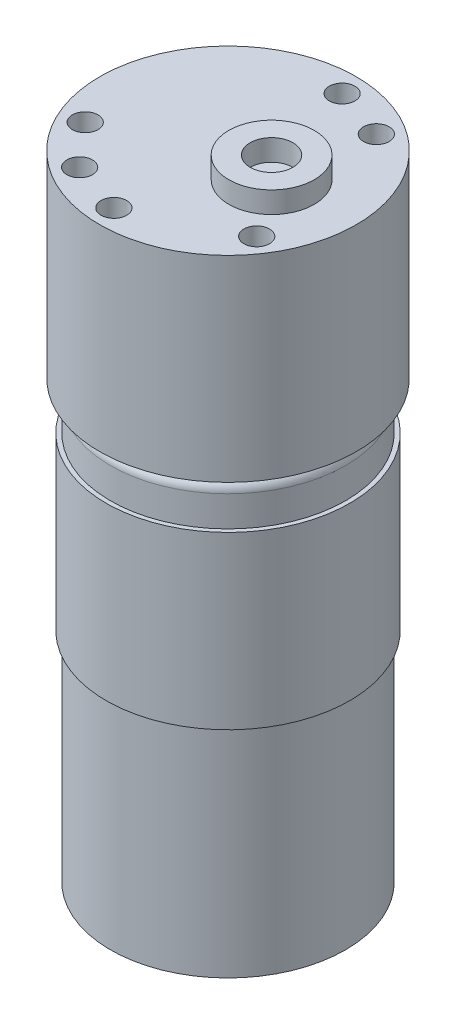
from build123d import *

# Parameters (mm, degrees)
SKETCH5_R             = 1.5
CUT_EXTRUDE1_DEPTH    = 4
SKETCH3_R             = 5
SKETCH3_R_2           = 2.5
BOSS_EXTRUDE3_DEPTH   = 2.5
BODY_MOVE_COPY1_ANGLE = 180
BODY_MOVE_COPY2_ANGLE = 180
BODY_MOVE_COPY3_ANGLE = 90


with BuildPart() as part:
    # Sketch1 → Revolve1 (revolve)
    with BuildSketch(Plane.XY, mode=Mode.PRIVATE) as revolve1_sk:
        with BuildLine():
            Line((33.701320748, 0), (33.701320748, 13.75))
            Line((33.701320748, 13.75), (21.201320748, 13.75))
            Line((21.201320748, 13.75), (8.201320748, 13.75))
            Line((8.201320748, 13.75), (8.201320748, 14.25))
            Line((8.201320748, 14.25), (-11.798679252, 14.25))
            Line((-11.798679252, 14.25), (-11.798679252, 13.75))
            Line((-11.798679252, 13.75), (-15.358679252, 13.75))
            ThreePointArc((-15.358679252, 13.75), (-16.23549166, 13.386812409), (-16.598679252, 12.51))
            Line((-16.598679252, 12.51), (-16.598679252, 12.5))
            Line((-16.598679252, 12.5), (-17.398679252, 12.5))
            Line((-17.398679252, 12.5), (-17.398679252, 15.00458738))
            Line((-17.398679252, 15.00458738), (-40.398679252, 15.00458738))
            Line((-40.398679252, 15.00458738), (-40.398679252, 0))
            Line((-40.398679252, 0), (33.701320748, 0))
        make_face()
    revolve(revolve1_sk.sketch.rotate(Axis((59.495632986, 0, 0), (-1, 0, 0)), 90), axis=Axis((59.495632986, 0, 0), (-1, 0, 0)))

    # Sketch5 → Cut-Extrude1 (cut)
    with BuildSketch(Plane.ZY.offset(40.398679252)):
        with Locations((-12.5, 0)):
            Circle(SKETCH5_R)
        with Locations((-10.825317547, 6.25)):
            Circle(SKETCH5_R)
        with Locations((6.25, 10.825317547)):
            Circle(SKETCH5_R)
        with Locations((12.5, 0)):
            Circle(SKETCH5_R)
        with Locations((10.825317547, -6.25)):
            Circle(SKETCH5_R)
        with Locations((6.25, -10.825317547)):
            Circle(SKETCH5_R)
    extrude(amount=-CUT_EXTRUDE1_DEPTH, mode=Mode.SUBTRACT)

    # Sketch3 → Boss-Extrude3 (add)
    with BuildSketch(Plane.ZY.offset(40.398679252)):
        with Locations((0, 5.5)):
            Circle(SKETCH3_R)
        with Locations((0, 5.5)):
            Circle(SKETCH3_R_2, mode=Mode.SUBTRACT)
    extrude(amount=BOSS_EXTRUDE3_DEPTH)


with BuildPart() as part_1:
    # Body-Move/Copy1: moved
    add(part.part.moved(Location((0, 0, 0))).rotate(Axis((-4.598679252, 0, 0), (0, 0, 1)), BODY_MOVE_COPY1_ANGLE))


with BuildPart() as part_2:
    # Body-Move/Copy2: moved
    add(part_1.part.moved(Location((0, 0, 0))).rotate(Axis((-4.598679252, 0, 0), (1.0345263845412585e-14, -0.03535860277253268, 0.9993746890981252)), BODY_MOVE_COPY2_ANGLE))


with BuildPart() as part_3:
    # Body-Move/Copy3: moved
    add(part_2.part.rotate(Axis((-4.598679252, 0, 0), (0, 0, -1)), BODY_MOVE_COPY3_ANGLE))


with BuildPart() as part_4:
    # Body-Move/Copy4: moved
    add(part_3.part.moved(Location((74.015049938, 0, 0))))


solid = part_4.part
